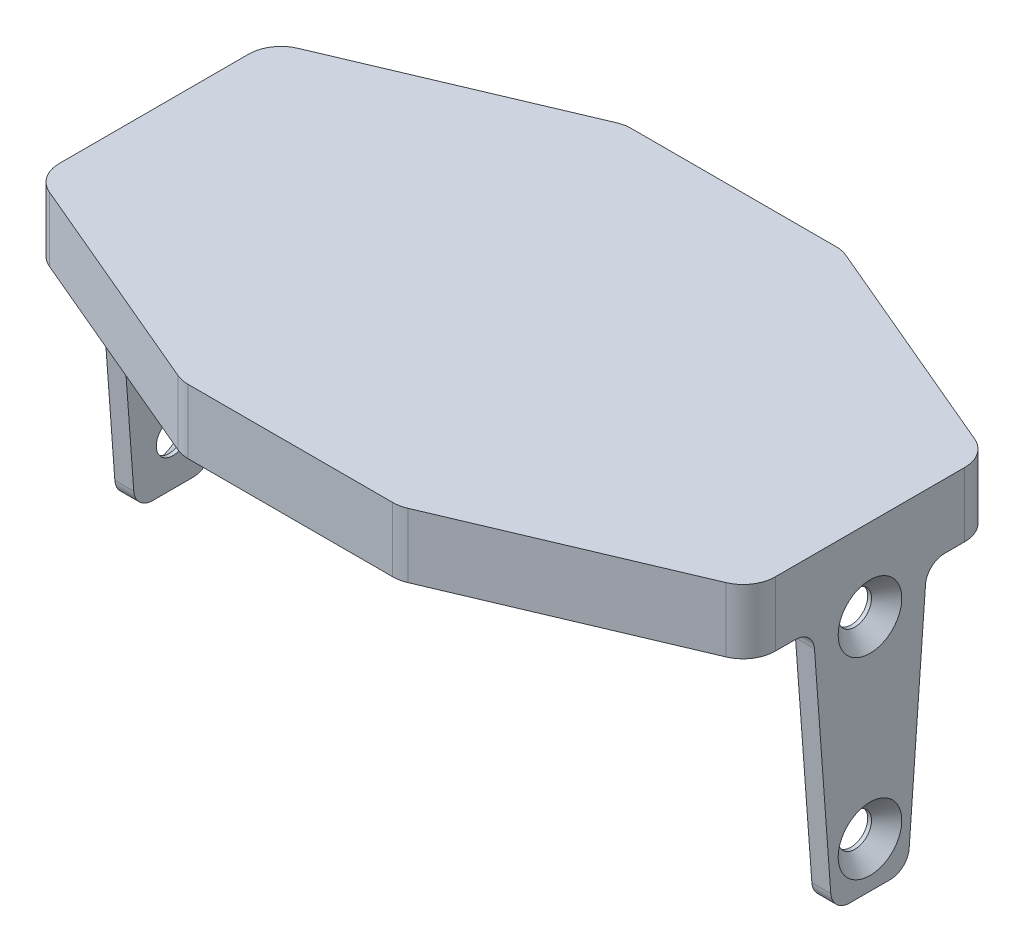
from build123d import *

# Parameters (mm, degrees)
BOSS_EXTRUDE1_DEPTH = 6
BOSS_EXTRUDE2_DEPTH = 2.5
BOSS_EXTRUDE4_DEPTH = 2.5
BOSS_EXTRUDE5_DEPTH = 2.5
FILLET1_R           = 2.5
SKETCH6_R           = 2.2
CUT_EXTRUDE1_DEPTH  = 105.505992651
CHAMFER1_SIZE       = 2
SKETCH8_R           = 1.25
BOSS_EXTRUDE6_DEPTH = 2.5
SKETCH10_W          = 2.5
SKETCH10_H          = 5
BOSS_EXTRUDE8_DEPTH = 7.5
SKETCH11_W          = 5
SKETCH11_H          = 2.5
BOSS_EXTRUDE9_DEPTH = 15
FILLET2_R           = 1


with BuildPart() as part:
    # Sketch1 → Boss-Extrude1 (new body)
    with BuildSketch(Plane(origin=(0, 0, 0), x_dir=(1, 0, 0), z_dir=(0, 1, 0))):
        with BuildLine():
            Line((44.658133395, 16.413194813), (15.158133395, 28.913194813))
            ThreePointArc((15.158133395, 28.913194813), (14.345997058, 29.164947656), (13.5, 29.25))
            Line((13.5, 29.25), (-13.5, 29.25))
            ThreePointArc((-13.5, 29.25), (-14.345997058, 29.164947656), (-15.158133395, 28.913194813))
            Line((-15.158133395, 28.913194813), (-44.658133395, 16.413194813))
            ThreePointArc((-44.658133395, 16.413194813), (-46.543272988, 14.846852474), (-47.25, 12.5))
            Line((-47.25, 12.5), (-47.25, -12.5))
            ThreePointArc((-47.25, -12.5), (-46.543272988, -14.846852474), (-44.658133395, -16.413194813))
            Line((-44.658133395, -16.413194813), (-15.158133395, -28.913194813))
            ThreePointArc((-15.158133395, -28.913194813), (-14.345997058, -29.164947656), (-13.5, -29.25))
            Line((-13.5, -29.25), (13.5, -29.25))
            ThreePointArc((13.5, -29.25), (14.345997058, -29.164947656), (15.158133395, -28.913194813))
            Line((15.158133395, -28.913194813), (44.658133395, -16.413194813))
            ThreePointArc((44.658133395, -16.413194813), (46.543272988, -14.846852474), (47.25, -12.5))
            Line((47.25, -12.5), (47.25, 12.5))
            ThreePointArc((47.25, 12.5), (46.543272988, 14.846852474), (44.658133395, 16.413194813))
        make_face()
        with BuildLine():
            Line((43.68276081, 14.111315511), (14.18276081, 26.611315511))
            ThreePointArc((14.18276081, 26.611315511), (13.84835173, 26.714978447), (13.5, 26.75))
            Line((13.5, 26.75), (-13.5, 26.75))
            ThreePointArc((-13.5, 26.75), (-13.84835173, 26.714978447), (-14.18276081, 26.611315511))
            Line((-14.18276081, 26.611315511), (-43.68276081, 14.111315511))
            ThreePointArc((-43.68276081, 14.111315511), (-44.45899476, 13.466351019), (-44.75, 12.5))
            Line((-44.75, 12.5), (-44.75, -12.5))
            ThreePointArc((-44.75, -12.5), (-44.45899476, -13.466351019), (-43.68276081, -14.111315511))
            Line((-43.68276081, -14.111315511), (-14.18276081, -26.611315511))
            ThreePointArc((-14.18276081, -26.611315511), (-13.84835173, -26.714978447), (-13.5, -26.75))
            Line((-13.5, -26.75), (13.5, -26.75))
            ThreePointArc((13.5, -26.75), (13.84835173, -26.714978447), (14.18276081, -26.611315511))
            Line((14.18276081, -26.611315511), (43.68276081, -14.111315511))
            ThreePointArc((43.68276081, -14.111315511), (44.45899476, -13.466351019), (44.75, -12.5))
            Line((44.75, -12.5), (44.75, 12.5))
            ThreePointArc((44.75, 12.5), (44.45899476, 13.466351019), (43.68276081, 14.111315511))
        make_face(mode=Mode.SUBTRACT)
    extrude(amount=BOSS_EXTRUDE1_DEPTH)

    # Sketch2 → Boss-Extrude2 (add)
    with BuildSketch(Plane(origin=(0, 6, 0), x_dir=(1, 0, 0), z_dir=(0, 1, 0))):
        with BuildLine():
            Line((-44.658133395, -16.413194813), (-15.158133395, -28.913194813))
            ThreePointArc((-15.158133395, -28.913194813), (-14.345997058, -29.164947656), (-13.5, -29.25))
            Line((-13.5, -29.25), (13.5, -29.25))
            ThreePointArc((13.5, -29.25), (14.345997058, -29.164947656), (15.158133395, -28.913194813))
            Line((15.158133395, -28.913194813), (44.658133395, -16.413194813))
            ThreePointArc((44.658133395, -16.413194813), (46.543272988, -14.846852474), (47.25, -12.5))
            Line((47.25, -12.5), (47.25, 12.5))
            ThreePointArc((47.25, 12.5), (46.543272988, 14.846852474), (44.658133395, 16.413194813))
            Line((44.658133395, 16.413194813), (15.158133395, 28.913194813))
            ThreePointArc((15.158133395, 28.913194813), (14.345997058, 29.164947656), (13.5, 29.25))
            Line((13.5, 29.25), (-13.5, 29.25))
            ThreePointArc((-13.5, 29.25), (-14.345997058, 29.164947656), (-15.158133395, 28.913194813))
            Line((-15.158133395, 28.913194813), (-44.658133395, 16.413194813))
            ThreePointArc((-44.658133395, 16.413194813), (-46.543272988, 14.846852474), (-47.25, 12.5))
            Line((-47.25, 12.5), (-47.25, -12.5))
            ThreePointArc((-47.25, -12.5), (-46.543272988, -14.846852474), (-44.658133395, -16.413194813))
        make_face()
    extrude(amount=BOSS_EXTRUDE2_DEPTH)

    # Sketch4 → Boss-Extrude4 (add)
    with BuildSketch(Plane(origin=(47.25, 0, 0), x_dir=(0, 0, -1), z_dir=(1, 0, 0))):
        Polygon((-7.5, 0), (7.5, 0), (5, -33.7), (-5, -33.7), align=None)
    extrude(amount=-BOSS_EXTRUDE4_DEPTH)

    # Sketch5 → Boss-Extrude5 (add)
    with BuildSketch(Plane.ZY.offset(47.25)):
        Polygon((7.5, 0), (5, -33.7), (-5, -33.7), (-7.5, 0), align=None)
    extrude(amount=-BOSS_EXTRUDE5_DEPTH)

    # Fillet1
    fillet1_edges = [part.edges().sort_by_distance(p)[0] for p in [
        (46, -33.7, -5),
        (46, 0, -7.5),
        (46, 0, 7.5),
        (46, -33.7, 5),
        (-46, -33.7, -5),
        (-46, -33.7, 5),
        (-46, 0, 7.5),
        (-46, 0, -7.5),
    ]]
    fillet(fillet1_edges, radius=FILLET1_R)

    # Sketch6 → Cut-Extrude1 (cut, through all)
    with BuildSketch(Plane(origin=(47.25, 0, 0), x_dir=(0, 0, -1), z_dir=(1, 0, 0))):
        with Locations((0, -2.3)):
            Circle(SKETCH6_R)
        with Locations((0, -27.7)):
            Circle(SKETCH6_R)
    extrude(amount=-CUT_EXTRUDE1_DEPTH, mode=Mode.SUBTRACT)

    # Chamfer1
    chamfer1_edges = [part.edges().sort_by_distance(p)[0] for p in [
        (-47.25, -2.3, 2.2),
        (47.25, -2.3, 2.2),
        (-47.25, -27.7, 2.2),
        (47.25, -27.7, 2.2),
    ]]
    chamfer(chamfer1_edges, length=CHAMFER1_SIZE)

    # Sketch8 → Boss-Extrude6 (add)
    with BuildSketch(Plane(origin=(0, 6, 0), x_dir=(-1, 0, 0), z_dir=(0, -1, 0))):
        with Locations(Location((40, 10.512979117, 0), (0, 0, 270))):
            Circle(SKETCH8_R)
        with Locations(Location((16.5, 20.470606235, 0), (0, 0, 270))):
            Circle(SKETCH8_R)
        with Locations(Location((-16.5, -20.470606235, 0), (0, 0, 270))):
            Circle(SKETCH8_R)
        with Locations(Location((-40, -10.512979117, 0), (0, 0, 270))):
            Circle(SKETCH8_R)
        with Locations(Location((-40, 10.512979117, 0), (0, 0, 270))):
            Circle(SKETCH8_R)
        with Locations(Location((-16.5, 20.470606235, 0), (0, 0, 270))):
            Circle(SKETCH8_R)
        with Locations(Location((40, -10.512979117, 0), (0, 0, 270))):
            Circle(SKETCH8_R)
        with Locations(Location((16.5, -20.470606235, 0), (0, 0, 270))):
            Circle(SKETCH8_R)
    extrude(amount=BOSS_EXTRUDE6_DEPTH)

    # Sketch10 → Boss-Extrude8 (add)
    with BuildSketch(Plane(origin=(0, 6, 0), x_dir=(-1, 0, 0), z_dir=(0, -1, 0))):
        with Locations((7.5, 0)):
            Rectangle(SKETCH10_W, SKETCH10_H)
    extrude(amount=BOSS_EXTRUDE8_DEPTH)

    # Sketch11 → Boss-Extrude9 (add)
    with BuildSketch(Plane.ZY.offset(6.25)):
        with Locations((0, -0.25)):
            Rectangle(SKETCH11_W, SKETCH11_H)
    extrude(amount=-BOSS_EXTRUDE9_DEPTH)

    # Fillet2
    fillet2_edges = [part.edges().sort_by_distance(p)[0] for p in [
        (-6.25, 6, 0),
        (-7.5, 6, 2.5),
        (-8.75, 6, 0),
        (-7.5, 6, -2.5),
        (-8.75, -1.5, 0),
        (8.75, -1.5, 0),
        (8.75, 1, 0),
        (-6.25, 1, 0),
    ]]
    fillet(fillet2_edges, radius=FILLET2_R)


solid = part.part
